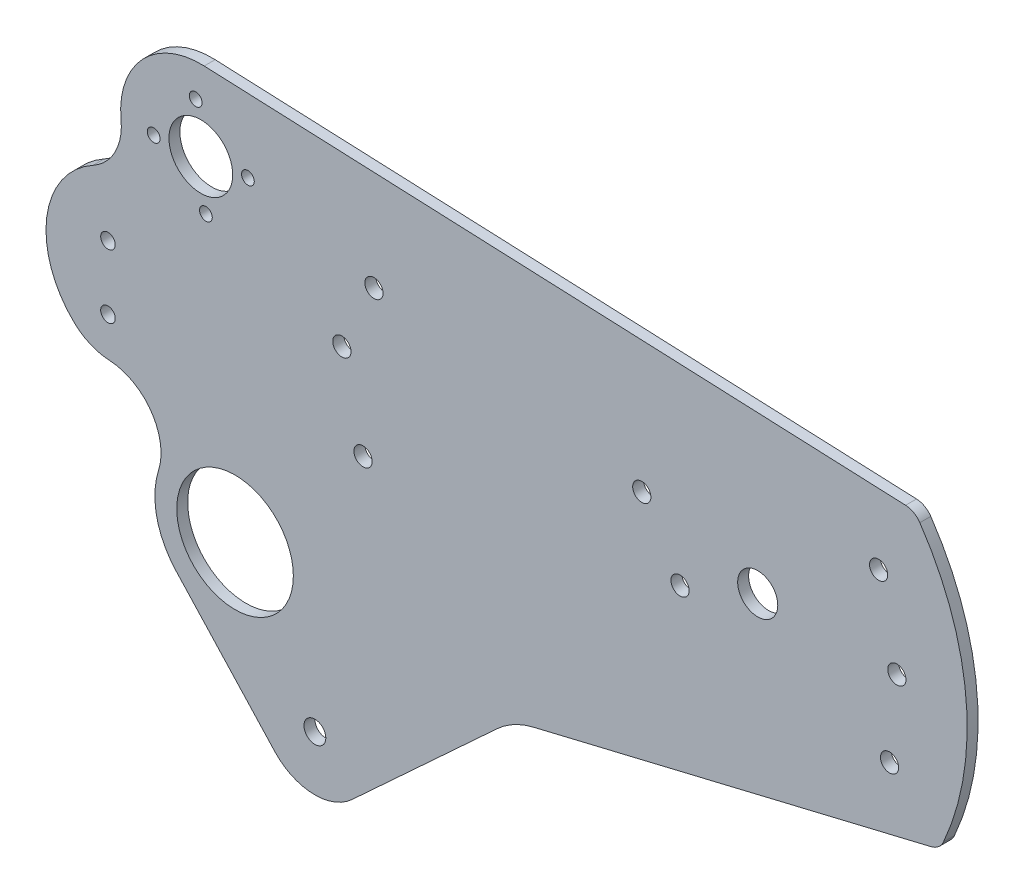
from build123d import *

# Parameters (mm, degrees)
SKETCH1_R           = 3
SKETCH1_R_2         = 2
SKETCH1_R_3         = 2.5
SKETCH1_R_4         = 1.75
SKETCH1_R_5         = 8.75
SKETCH1_R_6         = 5.5
SKETCH1_R_7         = 16
BOSS_EXTRUDE1_DEPTH = 3


with BuildPart() as part:
    # Sketch1 → Boss-Extrude1 (new body)
    with BuildSketch(Plane.XY):
        with BuildLine():
            ThreePointArc((-111.886028634, 49.480245878), (-128.824449864, 42.592956949), (-134.705774542, 25.279526249))
            ThreePointArc((-134.705774542, 25.279526249), (-136.343375771, 16.802270376), (-142.382746132, 10.632050724))
            ThreePointArc((-142.382746132, 10.632050724), (-155.099864059, -8.058287742), (-147.542861296, -29.364285714))
            ThreePointArc((-147.542861296, -29.364285714), (-143.125485566, -32.280163581), (-137.970351553, -33.480224156))
            ThreePointArc((-137.970351553, -33.480224156), (-126.431132561, -39.888203569), (-124.422839539, -52.93360637))
            ThreePointArc((-124.422839539, -52.93360637), (-124.888175134, -64.31939994), (-119.594822483, -74.410646153))
            Line((-119.594822483, -74.410646153), (-92.540517723, -103.740413224))
            ThreePointArc((-92.540517723, -103.740413224), (-82.119700521, -108.557935129), (-71.344567605, -104.595807028))
            Line((-71.344567605, -104.595807028), (-31.441449774, -67.788453323))
            ThreePointArc((-31.441449774, -67.788453323), (-26.802171393, -64.493076397), (-21.481893225, -62.473904985))
            Line((-21.481893225, -62.473904985), (87.599861039, -36.324111832))
            ThreePointArc((87.599861039, -36.324111832), (89.628937626, -35.308169791), (91, -33.5))
            ThreePointArc((91, -33.5), (97.203558128, 3.661751943), (84.51565505, 39.137054004))
            ThreePointArc((84.51565505, 39.137054004), (82.813644384, 40.69192784), (80.594954641, 41.317938046))
            Line((80.594954641, 41.317938046), (-111.886028634, 49.480245878))
        make_face()
        with Locations((-81.514845762, -93.570135067)):
            Circle(SKETCH1_R, mode=Mode.SUBTRACT)
        with Locations((-138.3, -22.75)):
            Circle(SKETCH1_R_2, mode=Mode.SUBTRACT)
        with Locations((-138.3, -5.25)):
            Circle(SKETCH1_R_2, mode=Mode.SUBTRACT)
        with Locations((-68.3, -21.5)):
            Circle(SKETCH1_R_3, mode=Mode.SUBTRACT)
        with Locations((-74.1, 1.7)):
            Circle(SKETCH1_R_3, mode=Mode.SUBTRACT)
        with Locations((-111.422396488, 14.575141755)):
            Circle(SKETCH1_R_4, mode=Mode.SUBTRACT)
        with Locations((-125.742976533, 26.1042782)):
            Circle(SKETCH1_R_4, mode=Mode.SUBTRACT)
        with Locations((-112.818118288, 27.5)):
            Circle(SKETCH1_R_5, mode=Mode.SUBTRACT)
        with Locations((-114.213840088, 40.424858245)):
            Circle(SKETCH1_R_4, mode=Mode.SUBTRACT)
        with Locations((-99.893260043, 28.8957218)):
            Circle(SKETCH1_R_4, mode=Mode.SUBTRACT)
        with Locations((-65.3, 20)):
            Circle(SKETCH1_R_3, mode=Mode.SUBTRACT)
        with Locations((18.7, -8.7)):
            Circle(SKETCH1_R_3, mode=Mode.SUBTRACT)
        with Locations((76.2, -22)):
            Circle(SKETCH1_R_3, mode=Mode.SUBTRACT)
        with Locations((40.017782272, 0)):
            Circle(SKETCH1_R_6, mode=Mode.SUBTRACT)
        with Locations((78.2, -0.1)):
            Circle(SKETCH1_R_3, mode=Mode.SUBTRACT)
        with Locations((8.2, 8.3)):
            Circle(SKETCH1_R_3, mode=Mode.SUBTRACT)
        with Locations((73.2, 22.3)):
            Circle(SKETCH1_R_3, mode=Mode.SUBTRACT)
        with Locations((-103.42383694, -59.494238188)):
            Circle(SKETCH1_R_7, mode=Mode.SUBTRACT)
    extrude(amount=BOSS_EXTRUDE1_DEPTH)


solid = part.part
